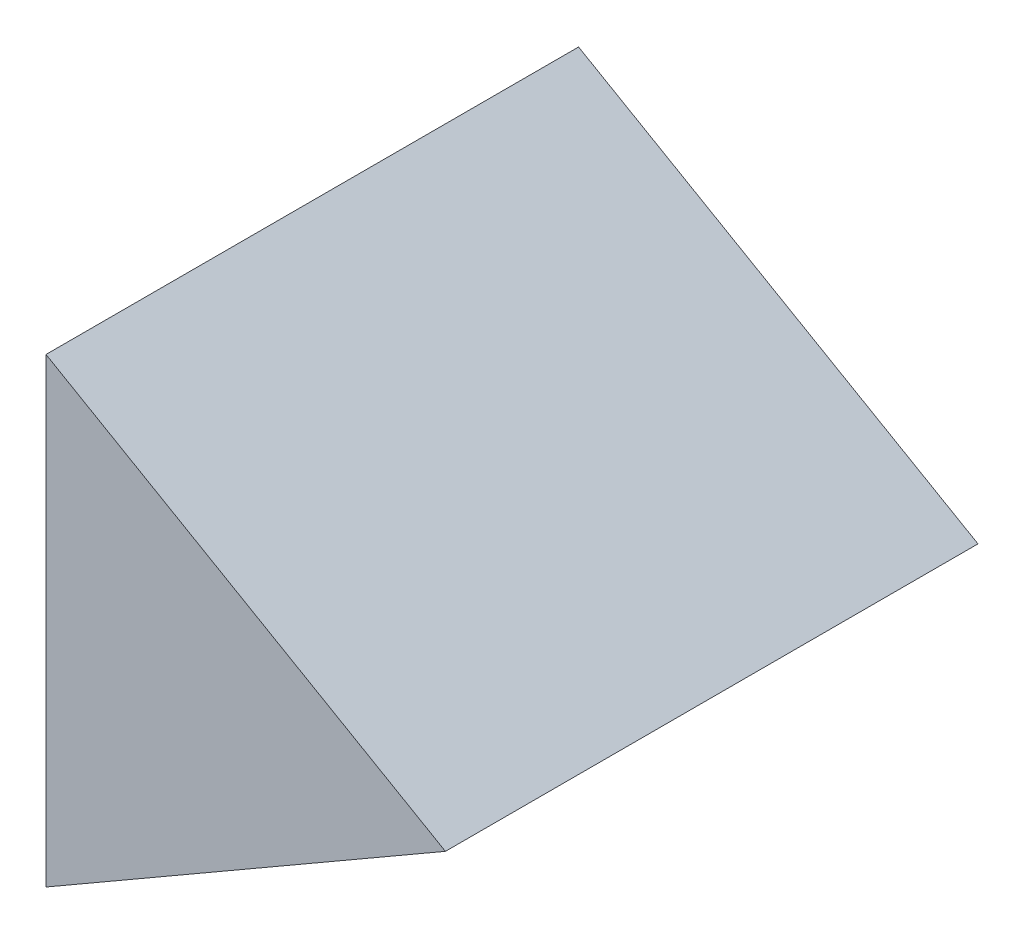
from build123d import *

# Parameters (mm, degrees)
EXTRUDE_1_DEPTH = 1000
EXTRUDE_2_DEPTH = 1000


with BuildPart() as part:
    # 草图1 → 凸台-拉伸1 (new body)
    with BuildSketch(Plane.XY):
        Polygon((500, 0), (-250, 433.012701892), (-250, -433.012701892), align=None)
    extrude(amount=EXTRUDE_1_DEPTH)

    # 草图2 → 凸台-拉伸2 (add)
    with BuildSketch(Plane.XY):
        Polygon((500, 0), (-250, 433.012701892), (-250, -433.012701892), align=None)
    extrude(amount=EXTRUDE_2_DEPTH)


solid = part.part
